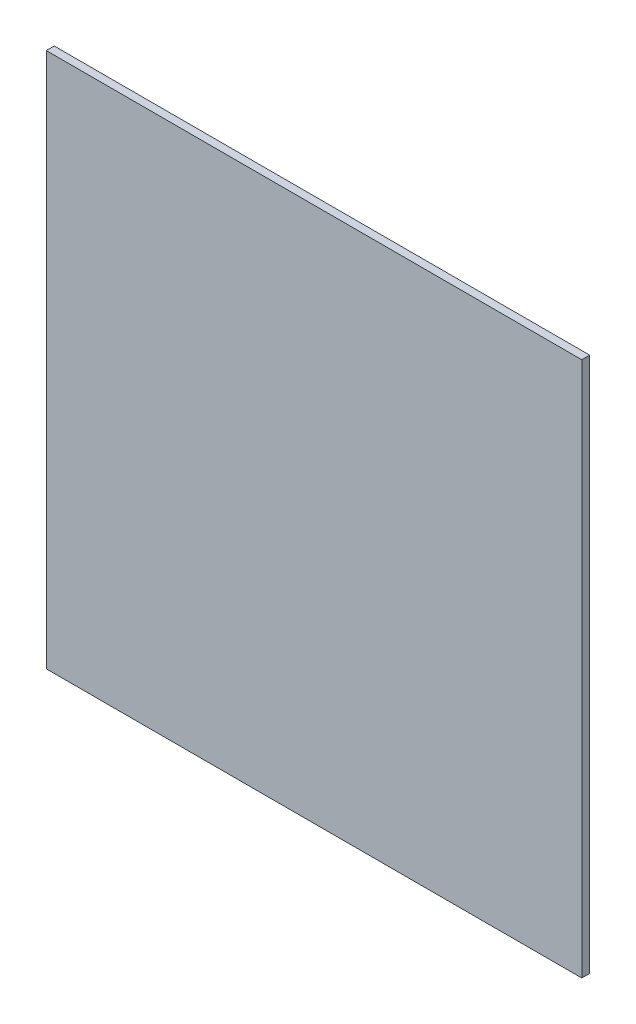
from build123d import *

# Parameters (mm, degrees)
SKETCH1_W     = 27
SKETCH1_H     = 27
PROFILE_DEPTH = 0.4


with BuildPart() as part:
    # Sketch1 → Profile (new body)
    with BuildSketch(Plane.XY):
        with Locations((13.5, 13.5)):
            Rectangle(SKETCH1_W, SKETCH1_H)
    extrude(amount=PROFILE_DEPTH)


solid = part.part
